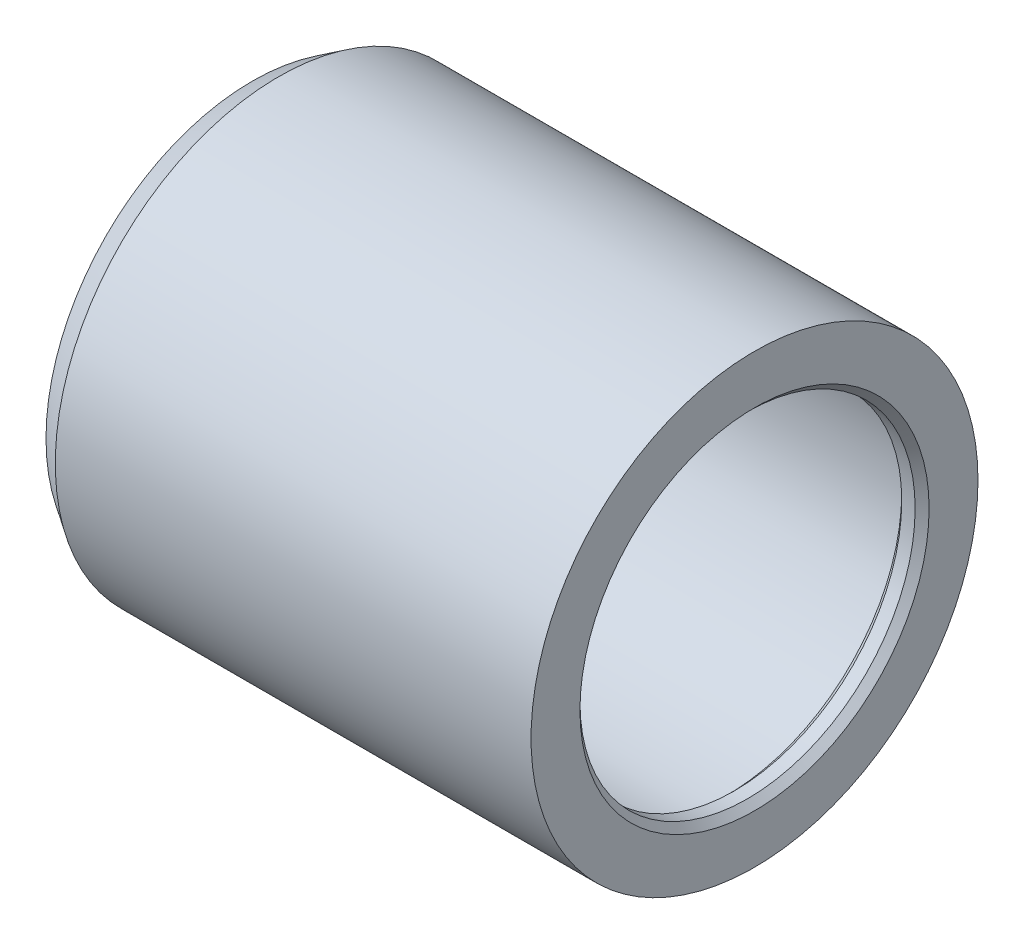
from build123d import *

# Parameters (mm, degrees)
CHAFL_N10_SIZE = 0.25


with BuildPart() as part:
    # Sketch1 → Revolve1 (revolve)
    with BuildSketch(Plane.XY, mode=Mode.PRIVATE) as revolve1_sk:
        Polygon((-17.979823496, 7.383932563), (-17.031162834, 8), (0, 8), (0, 6), (-0.979823496, 6), (-0.979823496, 6.888071888), (-17.979823496, 6.888071888), align=None)
    revolve(revolve1_sk.sketch.rotate(Axis((0, 0, 0), (-1, 0, 0)), 90), axis=Axis((0, 0, 0), (-1, 0, 0)))

    # Chaflán10
    chafl_n10_edges = [part.edges().sort_by_distance(p)[0] for p in [
        (-0.979823496, 0, 6),
        (-17.979823496, 0, 6.888071888),
        (0, 0, 6),
    ]]
    chamfer(chafl_n10_edges, length=CHAFL_N10_SIZE)


solid = part.part
